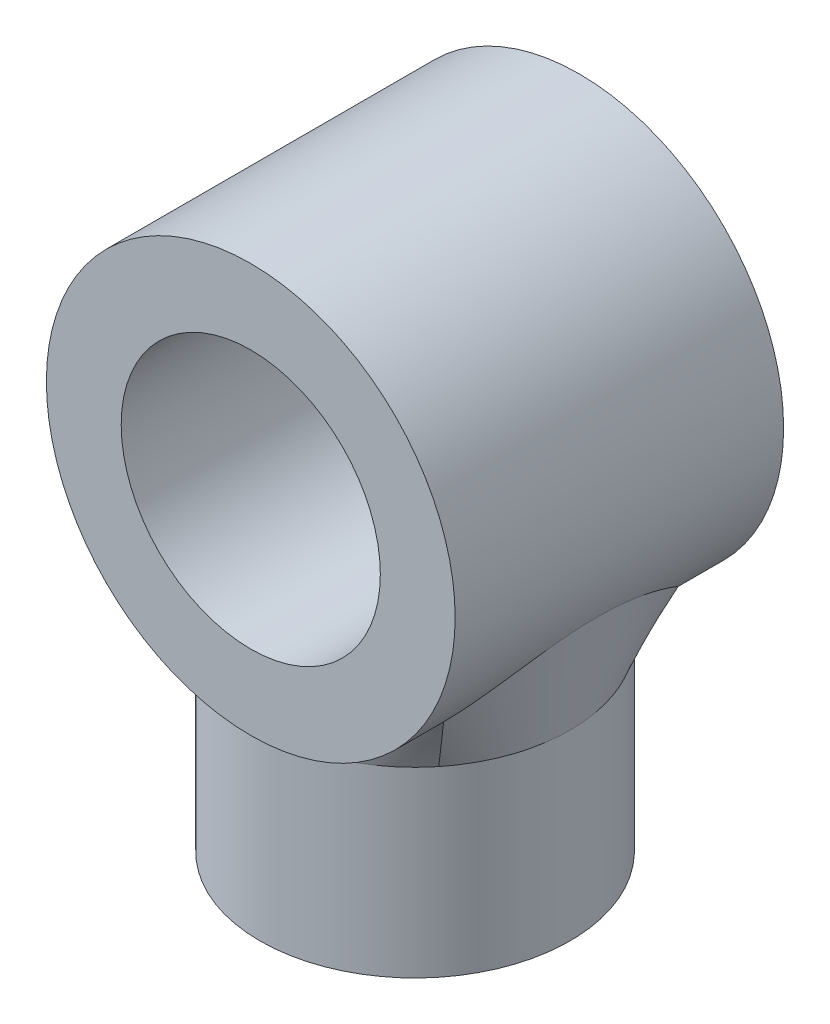
from build123d import *

# Parameters (mm, degrees)
SKETCH1_R                = 8.5
SKETCH1_R_2              = 6
BOSS_EXTRUDE1_DEPTH      = 10
BOSS_EXTRUDE2_DEPTH      = 9
BOSS_EXTRUDE2_DEPTH_BACK = 9
SKETCH3_R                = 11.2
SKETCH8_R                = 7.1
CUT_EXTRUDE1_DEPTH       = 18


with BuildPart() as part:
    # Sketch1 → Boss-Extrude1 (new body)
    with BuildSketch(Plane(origin=(0, 0, 0), x_dir=(1, 0, 0), z_dir=(0, 1, 0))):
        with Locations(Location((0, 0, 0), (0, 0, 270))):
            Circle(SKETCH1_R)
        with Locations(Location((0, 0, 0), (0, 0, 270))):
            Circle(SKETCH1_R_2, mode=Mode.SUBTRACT)
    extrude(amount=BOSS_EXTRUDE1_DEPTH)



with BuildPart() as body_2:
    # Sketch3 → Boss-Extrude2 (new, two sides: drawn at the far end of the back side and taken through both)
    with BuildSketch(Plane.XY.offset(-BOSS_EXTRUDE2_DEPTH_BACK)):
        with Locations((0, 21.2)):
            Circle(SKETCH3_R)
    extrude(amount=BOSS_EXTRUDE2_DEPTH + BOSS_EXTRUDE2_DEPTH_BACK)


with BuildPart() as part_1:
    add(part.part)

    add(body_2.part)  # Loft1 merges body 2
    # Sketch7 → Loft1 section 0
    with BuildSketch(Plane(origin=(0, 21.2, 0), x_dir=(1, 0, 0), z_dir=(0, 1, 0))):
        with BuildLine():
            Line((-11.2, -9), (11.2, -9))
            Line((11.2, -9), (11.2, 9))
            Line((11.2, 9), (-11.2, 9))
            Line((-11.2, 9), (-11.2, -9))
        make_face()
    # Sketch6 for Loft1 → Loft1 section 1
    with BuildSketch(Plane(origin=(0, 10, 0), x_dir=(1, 0, 0), z_dir=(0, 1, 0))):
        with BuildLine():
            # circular arc as an exact rational Bezier (weights 1, cos(half-angle), 1)
            Bezier((-6.625825946, -5.324324421), (0, -13.569796708), (6.625825946, -5.324324421), weights=[1, 0.626391108, 1])
            Bezier((6.625825946, -5.324324421), (10.904300926, 0), (6.625825946, 5.324324421), weights=[1, 0.779508935, 1])
            Bezier((6.625825946, 5.324324421), (0, 13.569796708), (-6.625825946, 5.324324421), weights=[1, 0.626391108, 1])
            Bezier((-6.625825946, 5.324324421), (-10.904300926, 0), (-6.625825946, -5.324324421), weights=[1, 0.779508935, 1])
        make_face()
    loft()

    # Sketch8 → Cut-Extrude1 (cut)
    with BuildSketch(Plane.XY.offset(9)):
        with Locations((0, 21.2)):
            Circle(SKETCH8_R)
    extrude(amount=-CUT_EXTRUDE1_DEPTH, mode=Mode.SUBTRACT)


solid = part_1.part
